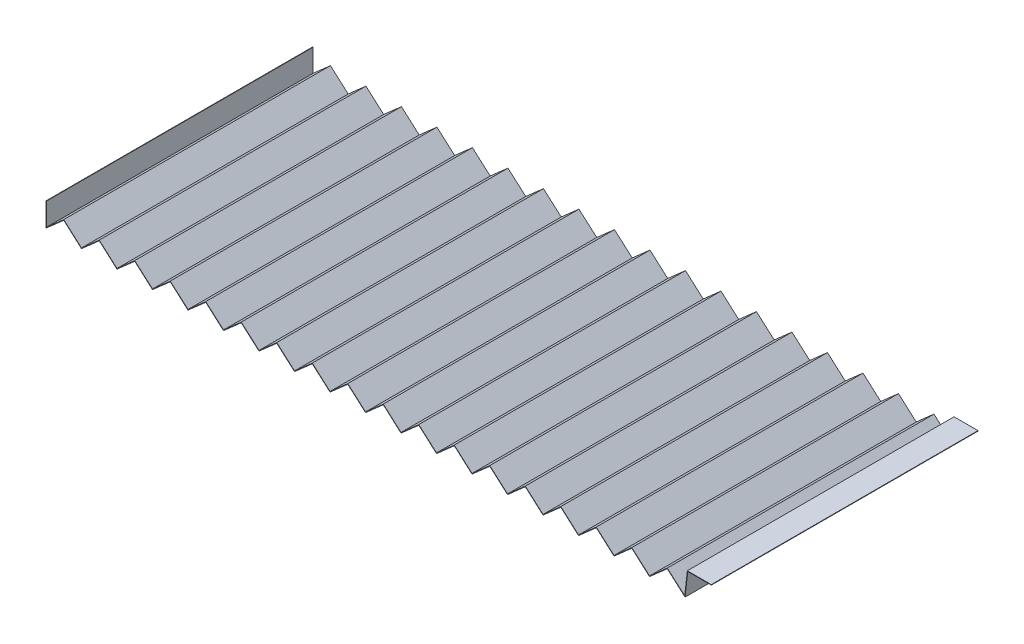
from build123d import *

# Parameters (mm, degrees)
EXTRUDE_THIN1_DEPTH = 85


with BuildPart() as part:
    # Sketch1 → Extrude-Thin1 (new, symmetric)
    with BuildSketch(Plane.XY):
        Polygon((0, 15.1), (0, 0), (11.315623666, 9.998332913), (22.631247332, 0), (33.946870998, 9.998332913), (45.262494664, 0), (56.57811833, 9.998332913), (67.893741996, 0), (79.209365662, 9.998332913), (90.524989328, 0), (101.840612995, 9.998332913), (113.156236661, 0), (124.471860327, 9.998332913), (135.787483993, 0), (147.103107659, 9.998332913), (158.418731325, 0), (169.734354991, 9.998332913), (181.049978657, 0), (192.365602323, 9.998332913), (203.681225989, 0), (214.996849655, 9.998332913), (226.312473321, 0), (237.628096987, 9.998332913), (248.943720653, 0), (260.259344319, 9.998332913), (271.574967985, 0), (282.890591652, 9.998332913), (294.206215318, 0), (305.521838984, 9.998332913), (316.83746265, 0), (328.153086316, 9.998332913), (339.468709982, 0), (350.784333648, 9.998332913), (362.099957314, 0), (373.41558098, 9.998332913), (384.731204646, 0), (396.046828312, 9.998332913), (407.362451978, 0), (409.097387136, 15), (424.097387136, 15), (424.097387136, 15.3), (408.830085839, 15.3), (407.130463898, 0.605312996), (396.046828312, 10.398664361), (384.731204646, 0.400331447), (373.41558098, 10.398664361), (362.099957314, 0.400331447), (350.784333648, 10.398664361), (339.468709982, 0.400331447), (328.153086316, 10.398664361), (316.83746265, 0.400331447), (305.521838984, 10.398664361), (294.206215318, 0.400331447), (282.890591652, 10.398664361), (271.574967985, 0.400331447), (260.259344319, 10.398664361), (248.943720653, 0.400331447), (237.628096987, 10.398664361), (226.312473321, 0.400331447), (214.996849655, 10.398664361), (203.681225989, 0.400331447), (192.365602323, 10.398664361), (181.049978657, 0.400331447), (169.734354991, 10.398664361), (158.418731325, 0.400331447), (147.103107659, 10.398664361), (135.787483993, 0.400331447), (124.471860327, 10.398664361), (113.156236661, 0.400331447), (101.840612995, 10.398664361), (90.524989328, 0.400331447), (79.209365662, 10.398664361), (67.893741996, 0.400331447), (56.57811833, 10.398664361), (45.262494664, 0.400331447), (33.946870998, 10.398664361), (22.631247332, 0.400331447), (11.315623666, 10.398664361), (0.3, 0.665407413), (0.3, 15.1), align=None)
    extrude(amount=EXTRUDE_THIN1_DEPTH, both=True)


solid = part.part
